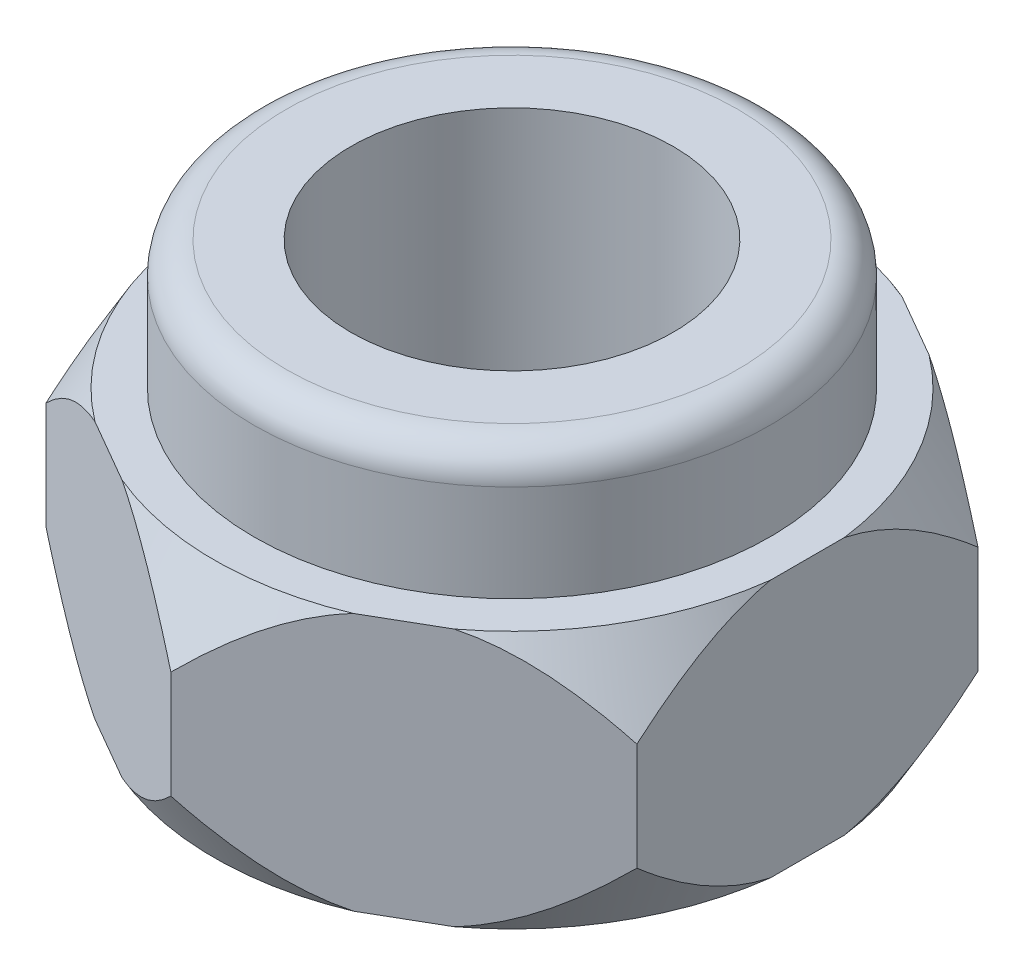
from build123d import *

# Parameters (mm, degrees)
SKETCH_1_R      = 1.5
EXTRUDE_1_DEPTH = 2.4
SKETCH_4_R      = 2.4
SKETCH_4_R_2    = 1.5
EXTRUDE_3_DEPTH = 1.2
FILLET_5_R      = 0.3
SCALE_1_SCALE   = 2


with BuildPart() as part:
    # 草图1 → 凸台-拉伸1 (new body)
    with BuildSketch(Plane(origin=(0, 0, 0), x_dir=(1, 0, 0), z_dir=(0, 1, 0))):
        Polygon((0, 3.175426481), (-2.75, 1.58771324), (-2.75, -1.58771324), (0, -3.175426481), (2.75, -1.58771324), (2.75, 1.58771324), align=None)
        with Locations(Location((0, 0, 0), (0, 0, 270))):
            Circle(SKETCH_1_R, mode=Mode.SUBTRACT)
    extrude(amount=EXTRUDE_1_DEPTH)

    # 草图3 → 切除-旋转7 (revolve, cut)
    with BuildSketch(Plane(origin=(0, 0, 0), x_dir=(0, 0, -1), z_dir=(1, 0, 0))):
        Polygon((0.384303775, 7.2), (4.083483307, 7.2), (4.083483307, -4.8), (0.297701235, -4.8), (0.297701235, -4.284366336), (3.464101615, 1.2), (0.384303775, 6.534366336), align=None)
    revolve(axis=Axis((0, 2.4, 0), (0, -1, 0)), mode=Mode.SUBTRACT)

    # 草图4 → 凸台-拉伸3 (add)
    with BuildSketch(Plane(origin=(0, 2.4, 0), x_dir=(1, 0, 0), z_dir=(0, 1, 0))):
        with Locations(Location((0, 0, 0), (0, 0, 270))):
            Circle(SKETCH_4_R)
        with Locations(Location((0, 0, 0), (0, 0, 270))):
            Circle(SKETCH_4_R_2, mode=Mode.SUBTRACT)
    extrude(amount=EXTRUDE_3_DEPTH)

    # 圆角5
    fillet_5_edges = [part.edges().sort_by_distance(p)[0] for p in [
        (0, 3.6, -2.4),
    ]]
    fillet(fillet_5_edges, radius=FILLET_5_R)


with BuildPart() as part_1:
    # 缩放比例1: scaled about (0, 1.599672866, 1e-09)
    add(part.part.scale(SCALE_1_SCALE).moved(Location((0, -1.599672866, -1e-09))))


solid = part_1.part
